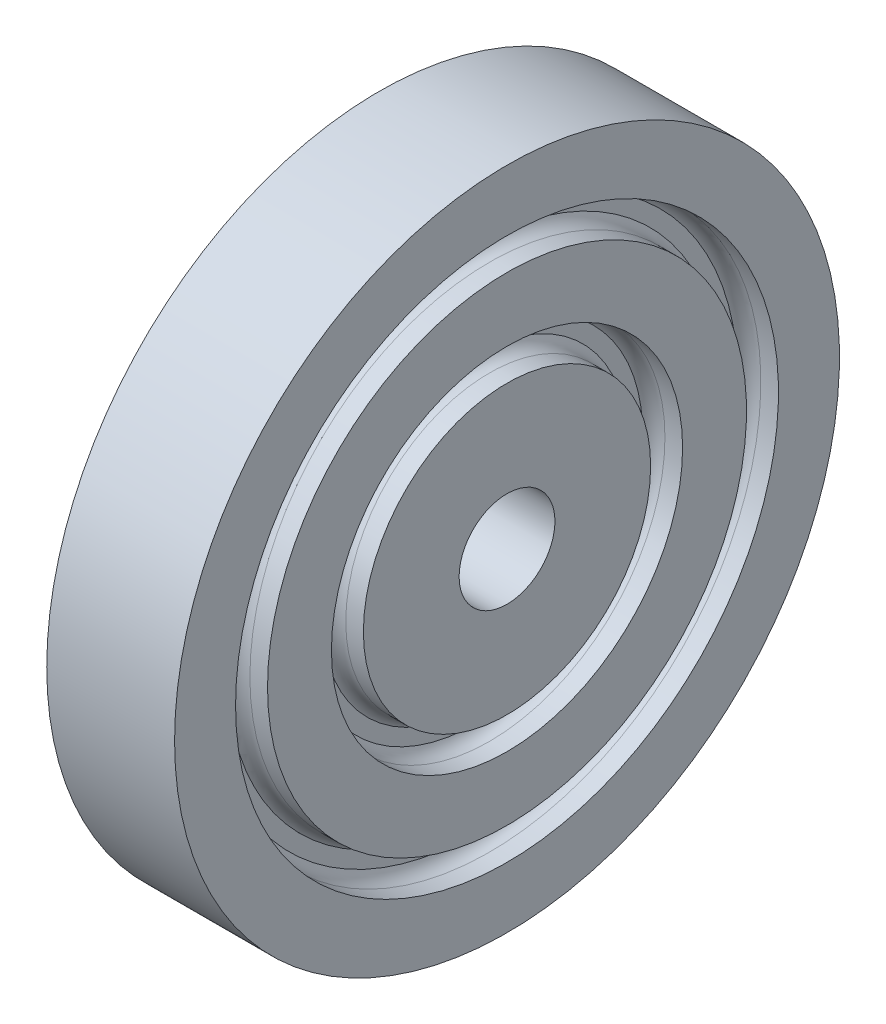
from build123d import *

# Parameters (mm, degrees)
SKETCH1_W = 1
SKETCH1_H = 0.25


with BuildPart() as part:
    # Sketch1 → Revolve1 (revolve)
    with BuildSketch(Plane.XY, mode=Mode.PRIVATE) as revolve1_sk:
        with BuildLine():
            Line((1, -0.127960571), (0, -0.127960571))
            Line((0, -0.127960571), (0, -0.267960571))
            Line((0, -0.267960571), (0.146155722, -0.267960571))
            ThreePointArc((0.146155722, -0.267960571), (0.20743948, -0.287596299), (0.252119262, -0.333910206))
            Line((0.252119262, -0.333910206), (0.252119262, -0.443874801))
            ThreePointArc((0.252119262, -0.443874801), (0.209436613, -0.495611488), (0.146155722, -0.517838097))
            Line((0.146155722, -0.517838097), (0, -0.517960571))
            Line((0, -0.517960571), (0, -1.240865466))
            Line((0, -1.240865466), (1, -1.240865466))
            Line((1, -1.240865466), (1, -0.492094096))
            Line((1, -0.492094096), (0.8620344, -0.492094096))
            ThreePointArc((0.8620344, -0.492094096), (0.796097541, -0.473288873), (0.75, -0.422531387))
            Line((0.75, -0.422531387), (0.75, -0.304480287))
            ThreePointArc((0.75, -0.304480287), (0.79791782, -0.258742158), (0.8620344, -0.242094096))
            Line((0.8620344, -0.242094096), (1, -0.242094096))
            Line((1, -0.242094096), (1, -0.127960571))
        make_face()
        with BuildLine():
            Line((1, 0.984944324), (0, 0.984944324))
            Line((0, 0.984944324), (0, 0.507905904))
            Line((0, 0.507905904), (0.1379656, 0.507905904))
            ThreePointArc((0.1379656, 0.507905904), (0.203902459, 0.489100681), (0.25, 0.438343194))
            Line((0.25, 0.438343194), (0.25, 0.320292094))
            ThreePointArc((0.25, 0.320292094), (0.20208218, 0.274553965), (0.1379656, 0.257905904))
            Line((0.1379656, 0.257905904), (0, 0.257905904))
            Line((0, 0.257905904), (0, 0.122039429))
            Line((0, 0.122039429), (1, 0.122039429))
            Line((1, 0.122039429), (1, 0.257905904))
            Line((1, 0.257905904), (0.8620344, 0.257905904))
            ThreePointArc((0.8620344, 0.257905904), (0.79791782, 0.274553965), (0.75, 0.320292094))
            Line((0.75, 0.320292094), (0.75, 0.438343194))
            ThreePointArc((0.75, 0.438343194), (0.796097541, 0.489100681), (0.8620344, 0.507905904))
            Line((0.8620344, 0.507905904), (1, 0.507905904))
            Line((1, 0.507905904), (1, 0.984944324))
        make_face()
        with Locations((0.5, -0.002960571)):
            Rectangle(SKETCH1_W, SKETCH1_H)
    revolve(revolve1_sk.sketch.rotate(Axis((-1.071343949, -1.615573452, 0), (1, 0, 0)), 90), axis=Axis((-1.071343949, -1.615573452, 0), (1, 0, 0)))


solid = part.part
